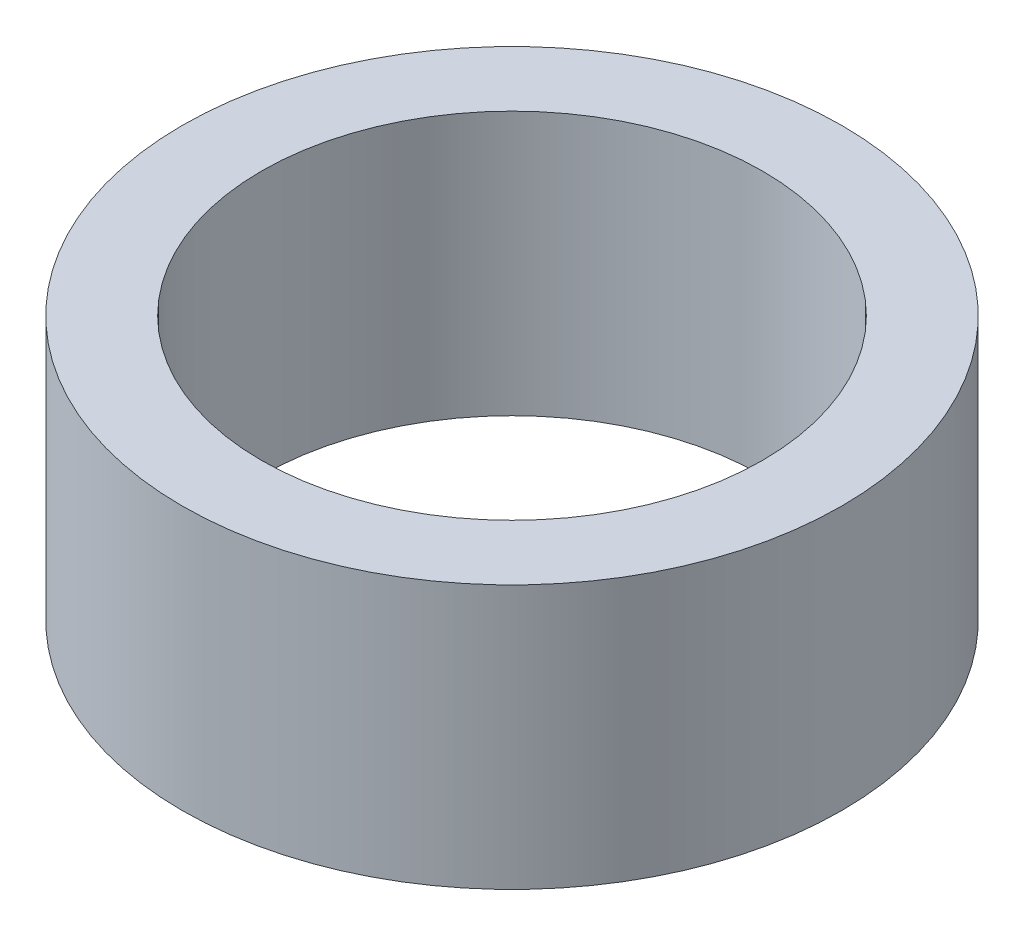
from build123d import *

# Parameters (mm, degrees)
SKETCH1_R           = 6.25
SKETCH1_R_2         = 4.75
BOSS_EXTRUDE1_DEPTH = 5


with BuildPart() as part:
    # Sketch1 → Boss-Extrude1 (new body)
    with BuildSketch(Plane(origin=(0, 0, 0), x_dir=(1, 0, 0), z_dir=(0, 1, 0))):
        with Locations(Location((0, 0, 0), (0, 0, 270))):
            Circle(SKETCH1_R)
        with Locations(Location((0, 0, 0), (0, 0, 270))):
            Circle(SKETCH1_R_2, mode=Mode.SUBTRACT)
    extrude(amount=BOSS_EXTRUDE1_DEPTH)


solid = part.part
